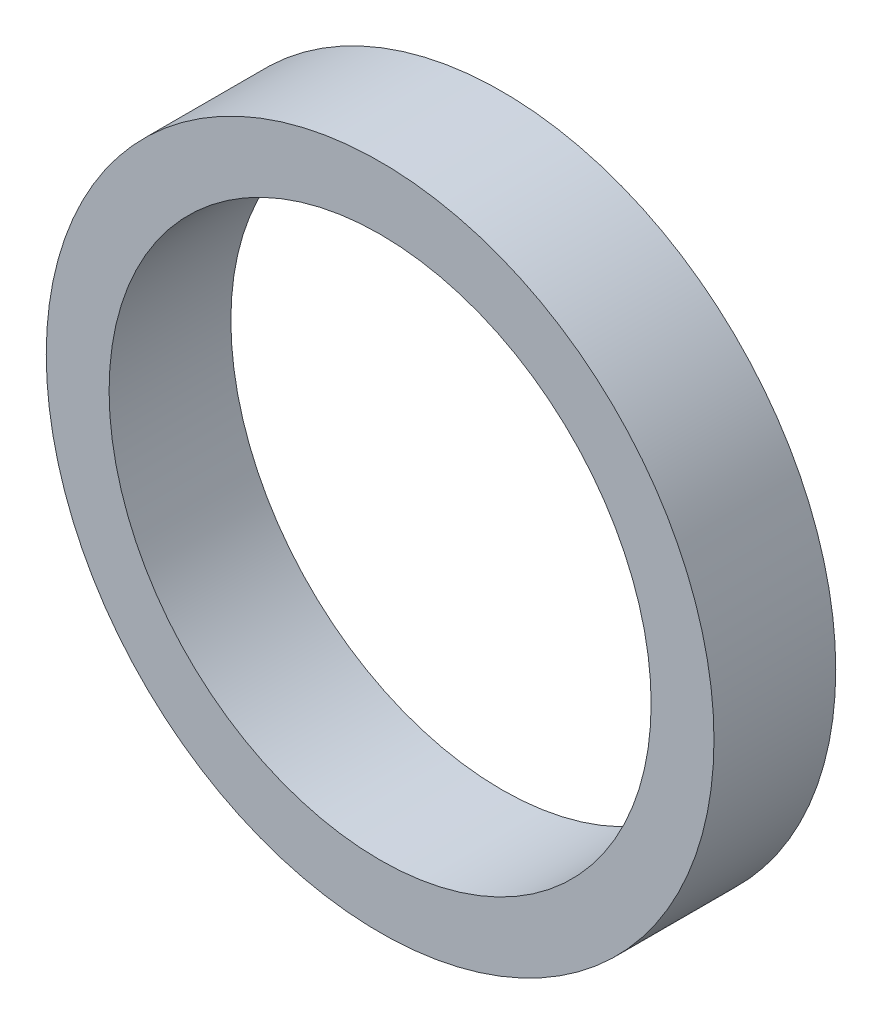
from build123d import *

# Parameters (mm, degrees)
SKETCH_1_R      = 17
SKETCH_1_R_2    = 13.8
EXTRUDE_1_DEPTH = 6.2


with BuildPart() as part:
    # 스케치1 → 보스-돌출1 (new body)
    with BuildSketch(Plane.XY):
        with Locations(Location((0, 0, 0), (0, 0, 180))):
            Circle(SKETCH_1_R)
        with Locations(Location((0, 0, 0), (0, 0, 180))):
            Circle(SKETCH_1_R_2, mode=Mode.SUBTRACT)
    extrude(amount=EXTRUDE_1_DEPTH)


solid = part.part
